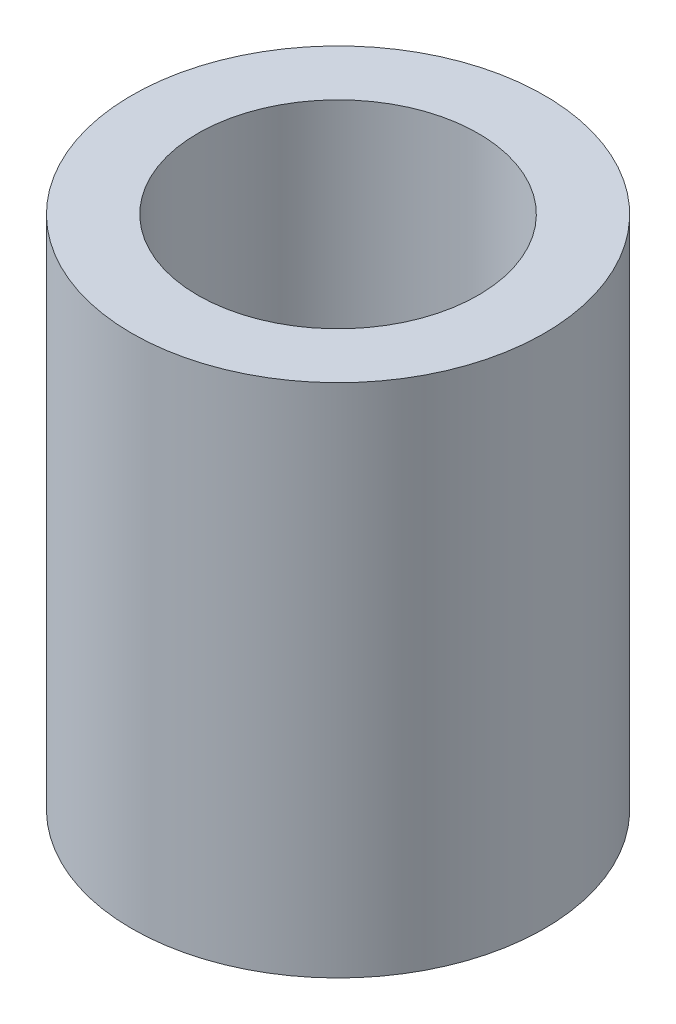
from build123d import *

# Parameters (mm, degrees)
SKETCH1_R           = 2.5
SKETCH1_R_2         = 1.7
BOSS_EXTRUDE1_DEPTH = 6.25


with BuildPart() as part:
    # Sketch1 → Boss-Extrude1 (new body)
    with BuildSketch(Plane(origin=(0, 0, 0), x_dir=(1, 0, 0), z_dir=(0, 1, 0))):
        with Locations(Location((0, 0, 0), (0, 0, 270))):
            Circle(SKETCH1_R)
        with Locations(Location((0, 0, 0), (0, 0, 270))):
            Circle(SKETCH1_R_2, mode=Mode.SUBTRACT)
    extrude(amount=BOSS_EXTRUDE1_DEPTH)


solid = part.part
